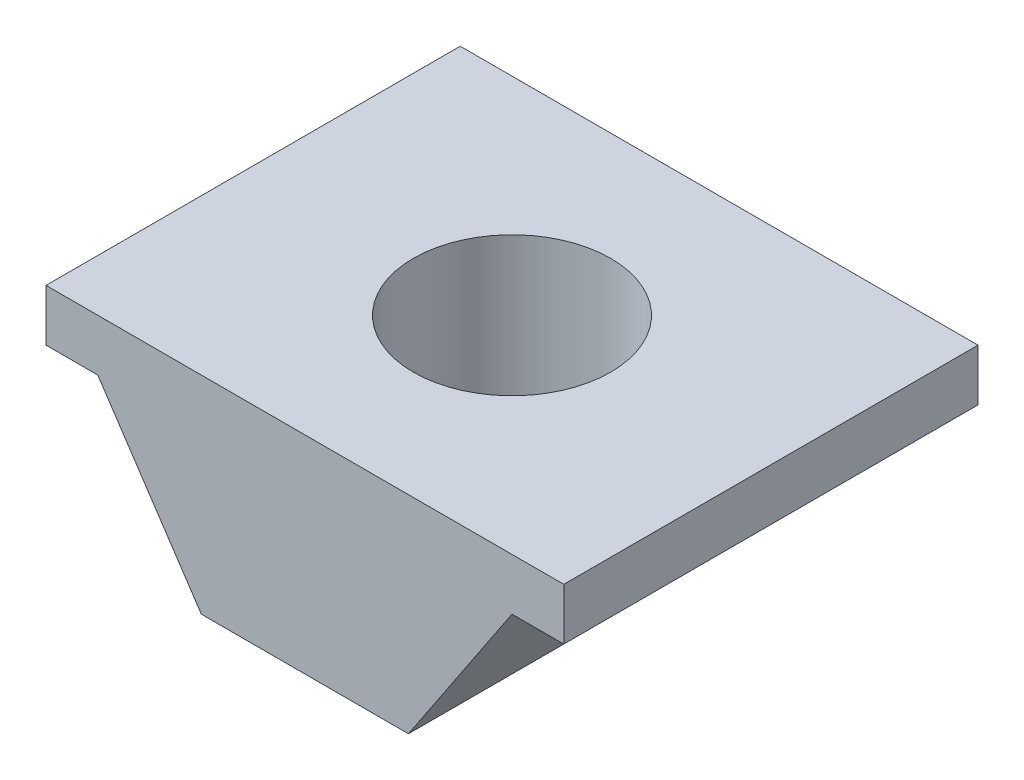
from build123d import *

# Parameters (mm, degrees)
SALIENTE_EXTRUIR1_DEPTH = 20
CORTAR_EXTRUIR1_START   = -10
CROQUIS2_R              = 4.7625
CORTAR_EXTRUIR1_DEPTH   = 10


with BuildPart() as part:
    # Croquis1 → Saliente-Extruir1 (new body)
    with BuildSketch(Plane.XY):
        Polygon((0, 0), (25, 0), (25, -2.5), (22.5, -2.5), (17.5, -10), (7.5, -10), (2.5, -2.5), (0, -2.5), align=None)
    extrude(amount=SALIENTE_EXTRUIR1_DEPTH)

    # Croquis2 → Cortar-Extruir1 (cut)
    with BuildSketch(Plane(origin=(0, 0, 0), x_dir=(1, 0, 0), z_dir=(0, 1, 0)).offset(CORTAR_EXTRUIR1_START)):
        with Locations(Location((12.5, -10, 0), (0, 0, 270))):
            Circle(CROQUIS2_R)
    extrude(amount=CORTAR_EXTRUIR1_DEPTH, mode=Mode.SUBTRACT)


solid = part.part
